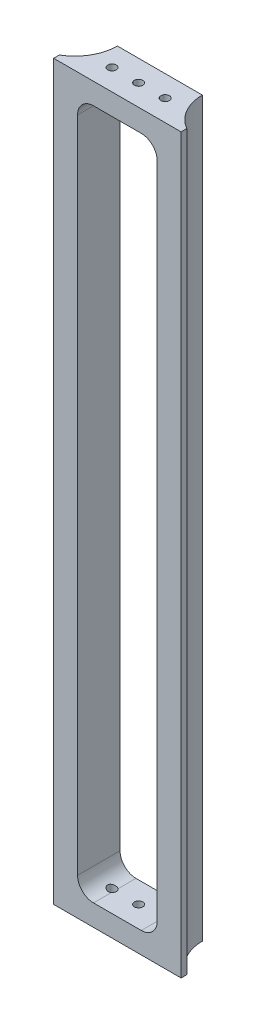
from build123d import *

# Parameters (mm, degrees)
BOSS_EXTRUDE2_DEPTH          = 438.15
CUT_EXTRUDE1_DEPTH           = 446.936132759
F_1_4_20_TAPPED_HOLE1_REACH  = 448.053
F_1_4_20_TAPPED_HOLE1_BORE_R = 2.5527
F_1_4_20_TAPPED_HOLE2_D      = 5.1054


with BuildPart() as part:
    # Sketch1 → Boss-Extrude2 (new body)
    with BuildSketch(Plane(origin=(0, 0, 0), x_dir=(1, 0, 0), z_dir=(0, 1, 0))):
        with BuildLine():
            Line((-66.283871769, 27.377862638), (-15.483871769, 27.377862638))
            ThreePointArc((-15.483871769, 27.377862638), (-12.080917025, 14.677862638), (-2.783871769, 5.380817382))
            Line((-2.783871769, 5.380817382), (-2.783871769, 1.977862638))
            Line((-2.783871769, 1.977862638), (-78.983871769, 1.977862638))
            Line((-78.983871769, 1.977862638), (-78.983871769, 5.380817382))
            ThreePointArc((-78.983871769, 5.380817382), (-69.686826513, 14.677862638), (-66.283871769, 27.377862638))
        make_face()
    extrude(amount=BOSS_EXTRUDE2_DEPTH)

    # Sketch6 → Cut-Extrude1 (cut, through all)
    with BuildSketch(Plane(origin=(0, 0, -27.377862638), x_dir=(-1, 0, 0), z_dir=(0, 0, -1))):
        with BuildLine():
            Line((26.596371769, 425.45), (55.171371769, 425.45))
            ThreePointArc((55.171371769, 425.45), (61.90656386, 422.660192091), (64.696371769, 415.925))
            Line((64.696371769, 415.925), (64.696371769, 22.225))
            ThreePointArc((64.696371769, 22.225), (61.90656386, 15.489807909), (55.171371769, 12.7))
            Line((55.171371769, 12.7), (26.596371769, 12.7))
            ThreePointArc((26.596371769, 12.7), (19.861179678, 15.489807909), (17.071371769, 22.225))
            Line((17.071371769, 22.225), (17.071371769, 415.925))
            ThreePointArc((17.071371769, 415.925), (19.861179678, 422.660192091), (26.596371769, 425.45))
        make_face()
    extrude(amount=-CUT_EXTRUDE1_DEPTH, mode=Mode.SUBTRACT)

    # 1/4-20 Tapped Hole1 bore → 1/4-20 Tapped Hole1 (cut, up to next)
    with BuildSketch(Plane(origin=(0, 0, 0), x_dir=(-1, 0, 0), z_dir=(0, -1, 0)), mode=Mode.PRIVATE) as f_1_4_20_tapped_hole1_sk1:
        with Locations((40.883871769, 14.677862638)):
            Circle(F_1_4_20_TAPPED_HOLE1_BORE_R)
    f_1_4_20_tapped_hole1_tool1 = extrude(f_1_4_20_tapped_hole1_sk1.sketch, amount=-F_1_4_20_TAPPED_HOLE1_REACH, mode=Mode.PRIVATE) & part.part
    # 1/4-20 Tapped Hole1 bore → 1/4-20 Tapped Hole1 (cut, up to next)
    with BuildSketch(Plane(origin=(0, 0, 0), x_dir=(-1, 0, 0), z_dir=(0, -1, 0)), mode=Mode.PRIVATE) as f_1_4_20_tapped_hole1_sk2:
        with Locations((56.758871769, 14.677862638)):
            Circle(F_1_4_20_TAPPED_HOLE1_BORE_R)
    f_1_4_20_tapped_hole1_tool2 = extrude(f_1_4_20_tapped_hole1_sk2.sketch, amount=-F_1_4_20_TAPPED_HOLE1_REACH, mode=Mode.PRIVATE) & part.part
    # 1/4-20 Tapped Hole1 bore → 1/4-20 Tapped Hole1 (cut, up to next)
    with BuildSketch(Plane(origin=(0, 0, 0), x_dir=(-1, 0, 0), z_dir=(0, -1, 0)), mode=Mode.PRIVATE) as f_1_4_20_tapped_hole1_sk3:
        with Locations((25.008871769, 14.677862638)):
            Circle(F_1_4_20_TAPPED_HOLE1_BORE_R)
    f_1_4_20_tapped_hole1_tool3 = extrude(f_1_4_20_tapped_hole1_sk3.sketch, amount=-F_1_4_20_TAPPED_HOLE1_REACH, mode=Mode.PRIVATE) & part.part
    add(f_1_4_20_tapped_hole1_tool1.solids().sort_by_distance((-40.883872, 0, -14.677863))[0], mode=Mode.SUBTRACT)
    add(f_1_4_20_tapped_hole1_tool2.solids().sort_by_distance((-56.758872, 0, -14.677863))[0], mode=Mode.SUBTRACT)
    add(f_1_4_20_tapped_hole1_tool3.solids().sort_by_distance((-25.008872, 0, -14.677863))[0], mode=Mode.SUBTRACT)

    # 1/4-20 Tapped Hole2 (through all)
    with Locations(Plane(origin=(0, 438.15, 0), x_dir=(1, 0, 0), z_dir=(0, 1, 0))):
        with Locations((-56.758871769, 14.677862638), (-40.883871769, 14.677862638), (-25.008871769, 14.677862638)):
            Hole(F_1_4_20_TAPPED_HOLE2_D / 2)


solid = part.part
